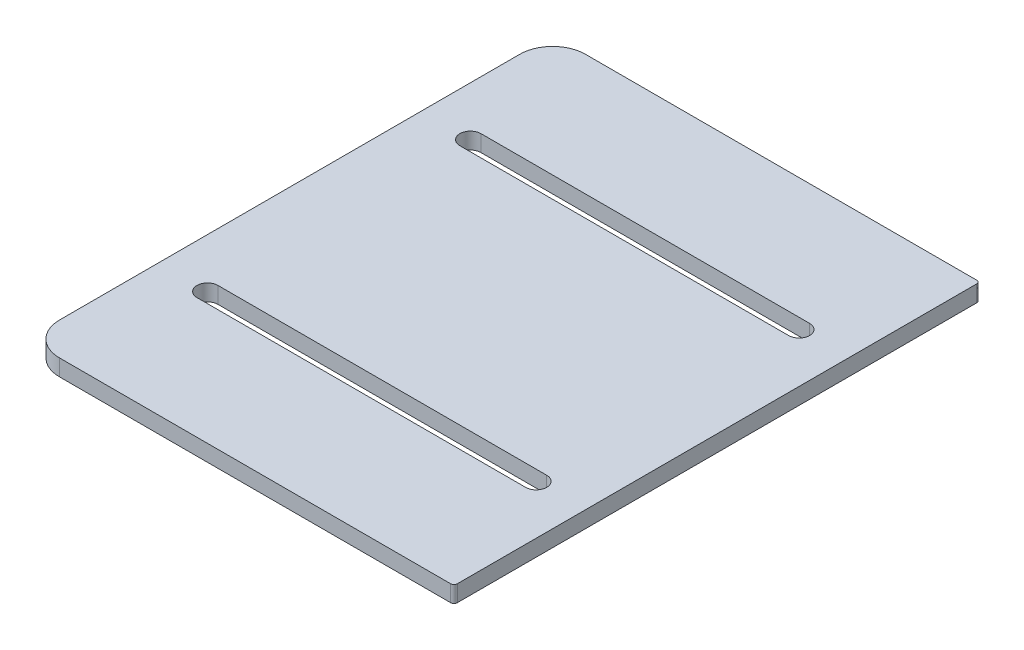
from build123d import *

# Parameters (mm, degrees)
SKETCH1_W           = 165.1
SKETCH1_H           = 203.2
BOSS_EXTRUDE1_DEPTH = 6.35
FILLET1_R           = 12.7
FILLET2_R           = 1.27


with BuildPart() as part:
    # Sketch1 → Boss-Extrude1 (new body)
    with BuildSketch(Plane(origin=(0, 0, 0), x_dir=(1, 0, 0), z_dir=(0, 1, 0))):
        Rectangle(SKETCH1_W, SKETCH1_H)
        with BuildLine():
            ThreePointArc((67.564, -50.8), (66.373681959, -53.673681959), (63.5, -54.864))
            Line((63.5, -54.864), (-63.5, -54.864))
            ThreePointArc((-63.5, -54.864), (-67.564, -50.8), (-63.5, -46.736))
            Line((-63.5, -46.736), (63.5, -46.736))
            ThreePointArc((63.5, -46.736), (66.373681959, -47.926318041), (67.564, -50.8))
        make_face(mode=Mode.SUBTRACT)
        with BuildLine():
            ThreePointArc((-63.5, 46.736), (-67.564, 50.8), (-63.5, 54.864))
            Line((-63.5, 54.864), (63.5, 54.864))
            ThreePointArc((63.5, 54.864), (66.373681959, 53.673681959), (67.564, 50.8))
            ThreePointArc((67.564, 50.8), (66.373681959, 47.926318041), (63.5, 46.736))
            Line((63.5, 46.736), (-63.5, 46.736))
        make_face(mode=Mode.SUBTRACT)
    extrude(amount=BOSS_EXTRUDE1_DEPTH)

    # Fillet1
    fillet1_edges = [part.edges().sort_by_distance(p)[0] for p in [
        (-82.55, 3.175, 101.6),
        (-82.55, 3.175, -101.6),
    ]]
    fillet(fillet1_edges, radius=FILLET1_R)

    # Fillet2
    fillet2_edges = [part.edges().sort_by_distance(p)[0] for p in [
        (82.55, 3.175, -101.6),
        (82.55, 3.175, 101.6),
    ]]
    fillet(fillet2_edges, radius=FILLET2_R)


solid = part.part
